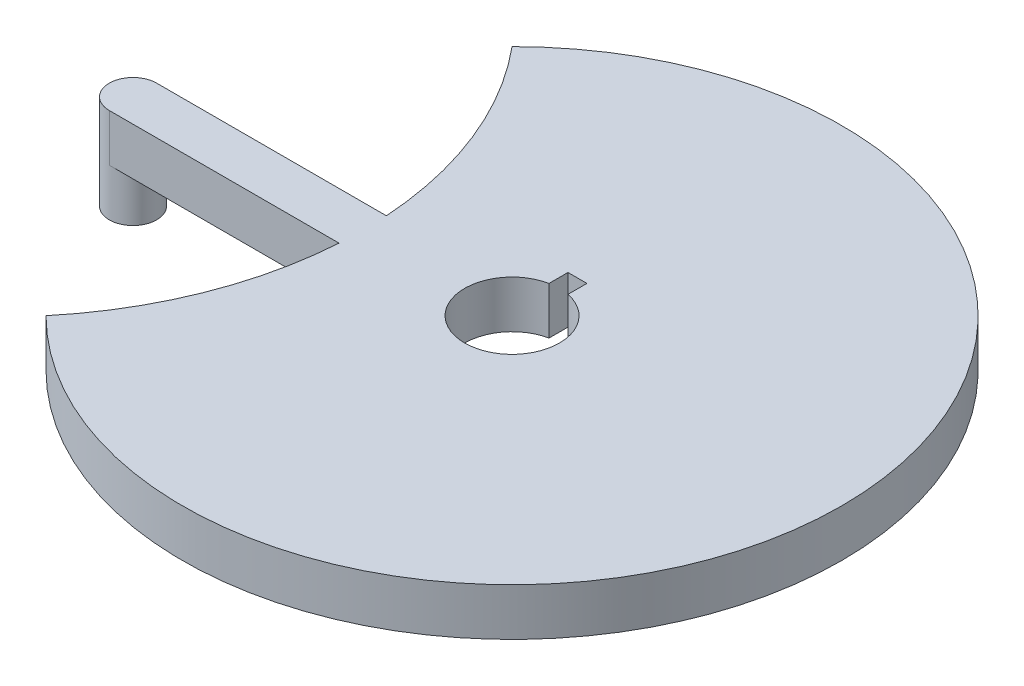
from build123d import *

# Parameters (mm, degrees)
EXTRUDE_1_DEPTH = 10
EXTRUDE_START   = 10
SKETCH_2_R      = 5
EXTRUDE_2_DEPTH = 10


with BuildPart() as part:
    # 草图1 → 凸台-拉伸1 (new body)
    with BuildSketch(Plane(origin=(0, 0, 0), x_dir=(1, 0, 0), z_dir=(0, 1, 0))):
        with BuildLine():
            Line((-80, 5), (-31.520674237, 5))
            ThreePointArc((-31.520674237, 5), (-36.841255051, 28.492771834), (-49.180194883, 49.180194883))
            ThreePointArc((-49.180194883, 49.180194883), (69.551298604, 0), (-49.180194883, -49.180194883))
            ThreePointArc((-49.180194883, -49.180194883), (-36.841255051, -28.492771834), (-31.520674237, -5))
            Line((-31.520674237, -5), (-80, -5))
            ThreePointArc((-80, -5), (-85, 0), (-80, 5))
        make_face()
        with BuildLine():
            Line((-2, 9.797958971), (-2, 13.797958971))
            Line((-2, 13.797958971), (2, 13.797958971))
            Line((2, 13.797958971), (2, 9.797958971))
            ThreePointArc((2, 9.797958971), (0, -10), (-2, 9.797958971))
        make_face(mode=Mode.SUBTRACT)
    extrude(amount=EXTRUDE_1_DEPTH)

    # 草图2 → 凸台-拉伸2 (add)
    with BuildSketch(Plane.XZ.offset(EXTRUDE_START)):
        with Locations(Location((-80, 0, 0), (0, 0, 270))):
            Circle(SKETCH_2_R)
    extrude(amount=-EXTRUDE_2_DEPTH)


solid = part.part
